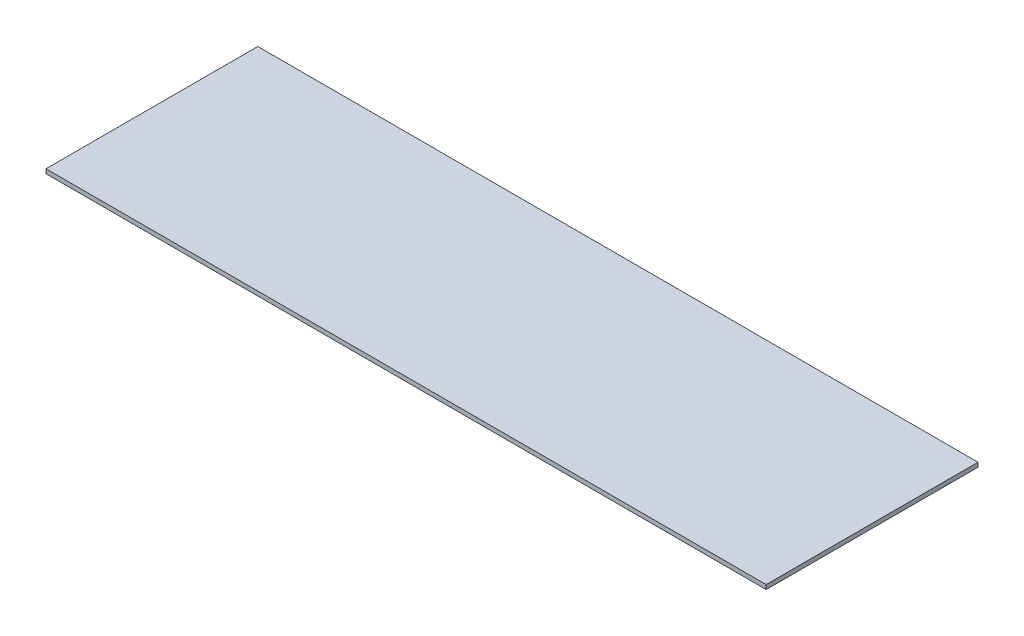
from build123d import *

# Parameters (mm, degrees)
SKETCH1_W           = 215.9
SKETCH1_H           = 63.5
BOSS_EXTRUDE1_DEPTH = 1.2954


with BuildPart() as part:
    # Sketch1 → Boss-Extrude1 (new body)
    with BuildSketch(Plane(origin=(0, 0, 0), x_dir=(1, 0, 0), z_dir=(0, 1, 0))):
        with Locations((107.95, 31.75)):
            Rectangle(SKETCH1_W, SKETCH1_H)
    extrude(amount=BOSS_EXTRUDE1_DEPTH)


solid = part.part
